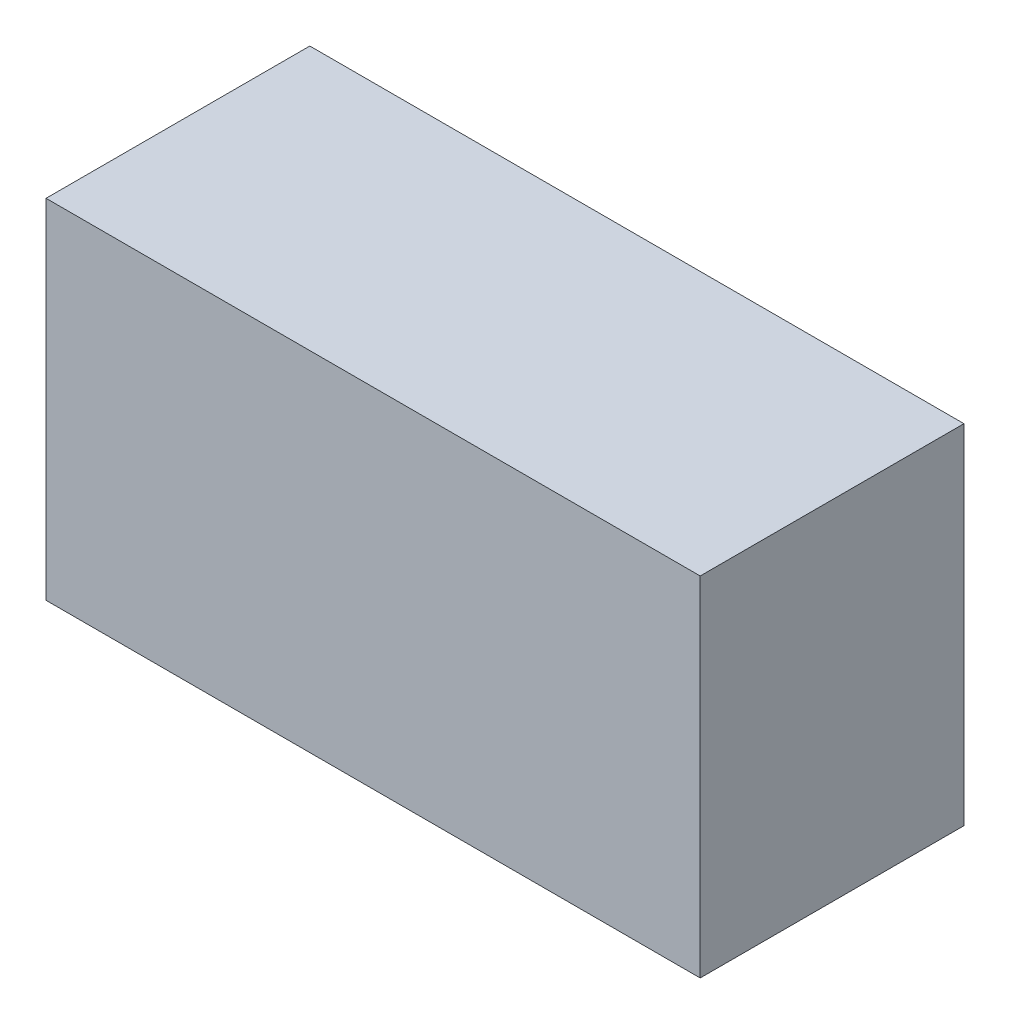
from build123d import *

# Parameters (mm, degrees)
SKETCH1_W           = 62
SKETCH1_H           = 25
BOSS_EXTRUDE1_DEPTH = 33


with BuildPart() as part:
    # Sketch1 → Boss-Extrude1 (new body)
    with BuildSketch(Plane(origin=(0, 0, 0), x_dir=(1, 0, 0), z_dir=(0, 1, 0))):
        with Locations((31, 12.5)):
            Rectangle(SKETCH1_W, SKETCH1_H)
    extrude(amount=BOSS_EXTRUDE1_DEPTH)


solid = part.part
